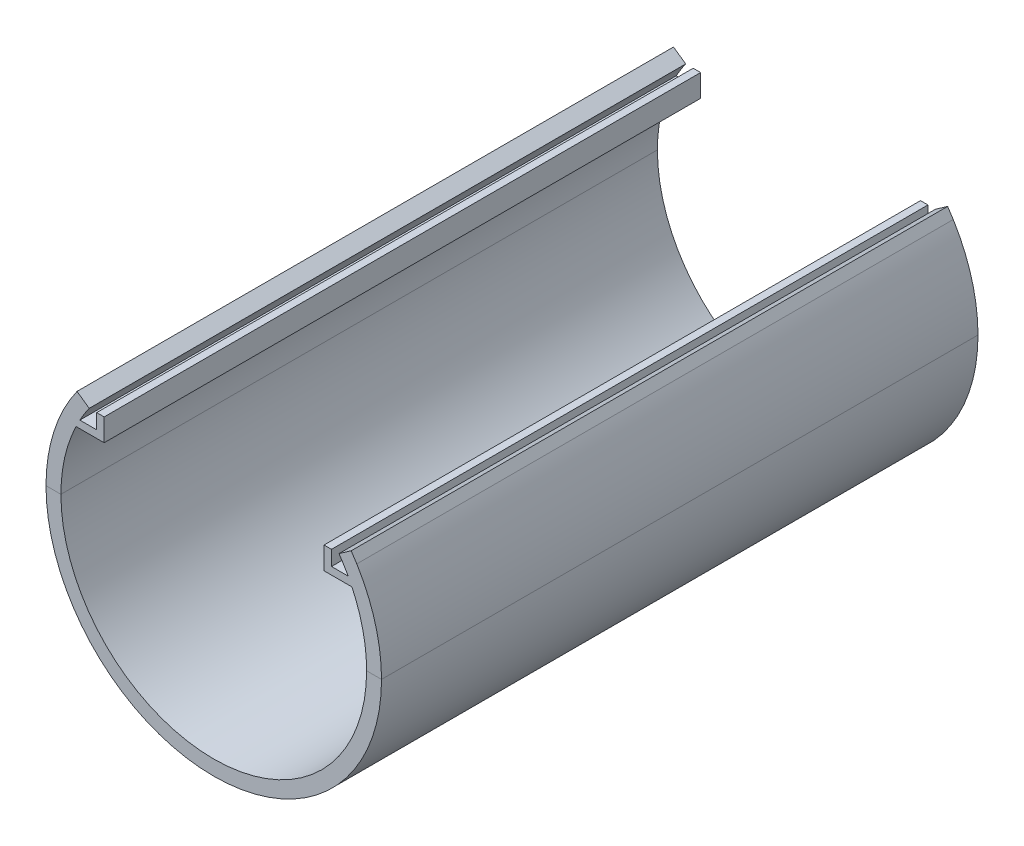
from build123d import *

# Parameters (mm, degrees)
SKETCH1_R           = 22.5
SKETCH1_R_2         = 20.5
BOSS_EXTRUDE1_DEPTH = 80
SKETCH2_W           = 45
SKETCH2_H           = 22.5
CUT_EXTRUDE1_DEPTH  = 87.095876789
SKETCH4_W           = 4.401808348
SKETCH4_H           = 1
SKETCH4_W_2         = 1
SKETCH4_H_2         = 3
BOSS_EXTRUDE2_DEPTH = 80


with BuildPart() as part:
    # Sketch1 → Boss-Extrude1 (new body)
    with BuildSketch(Plane.XY):
        Circle(SKETCH1_R)
        Circle(SKETCH1_R_2, mode=Mode.SUBTRACT)
    extrude(amount=BOSS_EXTRUDE1_DEPTH)

    # Sketch2 → Cut-Extrude1 (cut, through all)
    with BuildSketch(Plane.XY.offset(80)):
        with Locations((0, 11.25)):
            Rectangle(SKETCH2_W, SKETCH2_H)
    extrude(amount=-CUT_EXTRUDE1_DEPTH, mode=Mode.SUBTRACT)


with BuildPart() as body_2:
    # Sketch4 → Boss-Extrude2 (new body)
    with BuildSketch(Plane.XY.offset(80)):
        with BuildLine():
            ThreePointArc((22.5, 0), (21.654908627, 6.108594957), (19.183117125, 11.758316945))
            Line((19.183117125, 11.758316945), (19.183117125, 8.758316945))
            Line((19.183117125, 8.758316945), (18.534882905, 8.758316945))
            ThreePointArc((18.534882905, 8.758316945), (20.002688564, 4.488034116), (20.5, 0))
            Line((20.5, 0), (22.5, 0))
        make_face()
        Polygon((16.792616908, 11.758316945), (18.430920997, 12.905469818), (19.183117125, 11.758316945), align=None)
        with BuildLine():
            Line((19.183117125, 8.758316945), (19.183117125, 11.758316945))
            Line((19.183117125, 11.758316945), (16.792616908, 11.758316945))
            ThreePointArc((16.792616908, 11.758316945), (17.439231391, 10.776047906), (18.028456684, 9.758316945))
            ThreePointArc((18.028456684, 9.758316945), (18.288505966, 9.261778962), (18.534882905, 8.758316945))
            Line((18.534882905, 8.758316945), (19.183117125, 8.758316945))
        make_face()
        with BuildLine():
            Line((15.792616908, 9.758316945), (15.792616908, 11.758316945))
            Line((15.792616908, 11.758316945), (14.792616908, 11.758316945))
            Line((14.792616908, 11.758316945), (14.792616908, 8.758316945))
            Line((14.792616908, 8.758316945), (18.534882905, 8.758316945))
            ThreePointArc((18.534882905, 8.758316945), (18.288505966, 9.261778962), (18.028456684, 9.758316945))
            Line((18.028456684, 9.758316945), (15.792616908, 9.758316945))
        make_face()
        with BuildLine():
            Line((-16.702272837, 11.886298081), (-18.340620511, 13.033481472))
            ThreePointArc((-18.340620511, 13.033481472), (-21.43494765, 6.840542322), (-22.5, 0))
            Line((-22.5, 0), (-20.5, 0))
            ThreePointArc((-20.5, 0), (-19.527501033, 6.239126815), (-16.702272837, 11.886298081))
        make_face()
        with Locations((-16.903177011, 9.386298081)):
            Rectangle(SKETCH4_W, SKETCH4_H)
        with Locations((-15.202272837, 10.386298081)):
            Rectangle(SKETCH4_W_2, SKETCH4_H_2)
    extrude(amount=-BOSS_EXTRUDE2_DEPTH)


solid = Compound([part.part, body_2.part])
